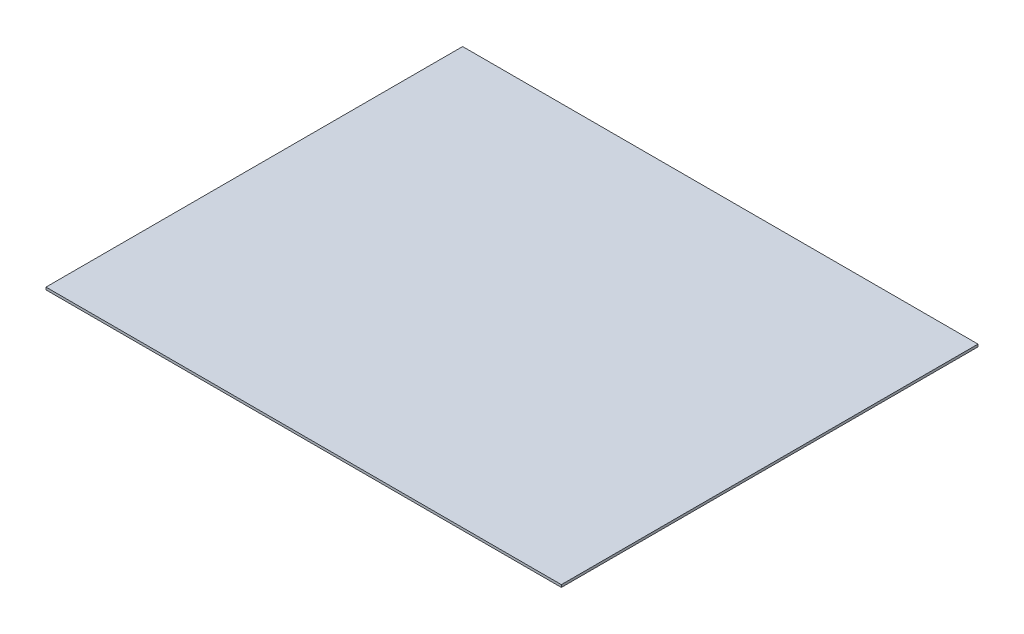
from build123d import *

# Parameters (mm, degrees)
SKETCH1_W           = 261
SKETCH1_H           = 211
BOSS_EXTRUDE1_DEPTH = 1.25


with BuildPart() as part:
    # Sketch1 → Boss-Extrude1 (new body)
    with BuildSketch(Plane(origin=(0, 0, 0), x_dir=(1, 0, 0), z_dir=(0, 1, 0))):
        with Locations((130.5, 105.5)):
            Rectangle(SKETCH1_W, SKETCH1_H)
    extrude(amount=BOSS_EXTRUDE1_DEPTH)


solid = part.part
